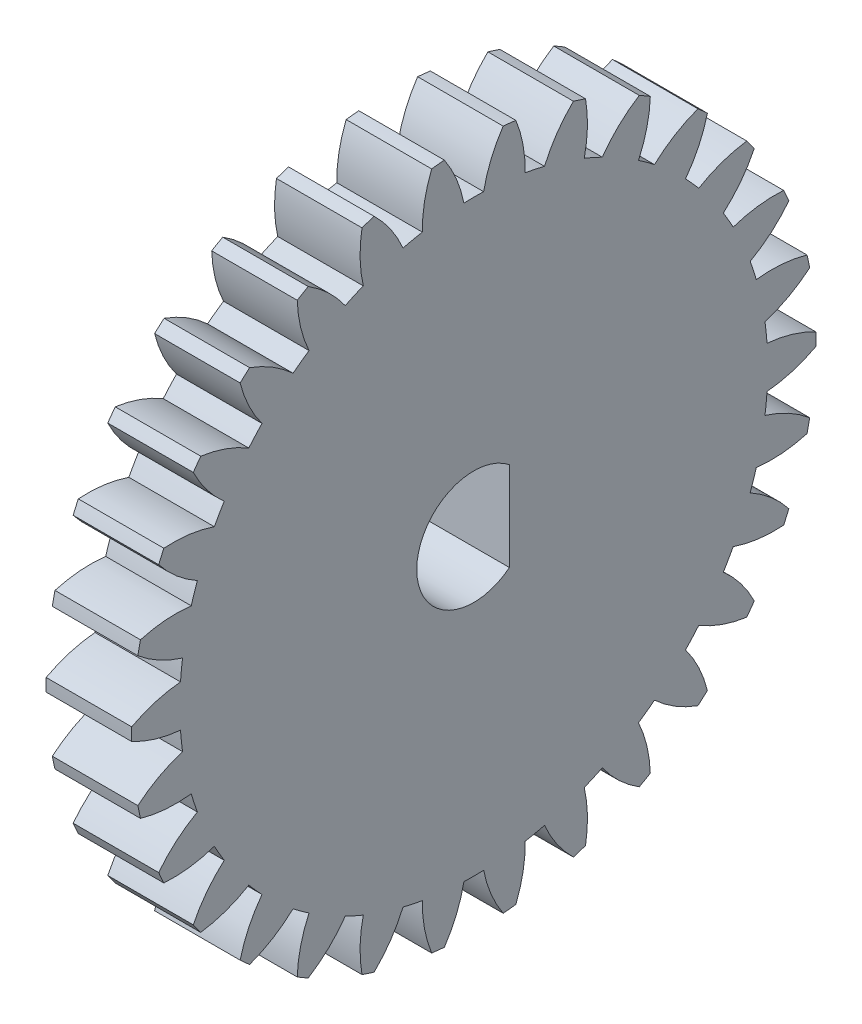
from build123d import *

# Parameters (mm, degrees)
BASPROSKE_W        = 12
BASPROSKE_H        = 24
TOOTHCUT_DEPTH     = 37
TEETHCUTS_COUNT    = 30
TEETHCUTS_ANGLE    = 348
BORSKE_R           = 0.4
BORE_DEPTH         = 50.0000508
SKETCH1_R          = 33.841637192
CUT_EXTRUDE1_DEPTH = 6
CUT_EXTRUDE2_DEPTH = 6


with BuildPart() as part:
    # BasProSke → Base-Revolve (revolve)
    with BuildSketch(Plane(origin=(0, 0, 0), x_dir=(1, 0, 0), z_dir=(0, 1, 0)), mode=Mode.PRIVATE) as base_revolve_sk:
        with Locations((6, 12)):
            Rectangle(BASPROSKE_W, BASPROSKE_H)
    revolve(base_revolve_sk.sketch.rotate(Axis((-10, 0, 0), (1, 0, 0)), 180), axis=Axis((-10, 0, 0), (1, 0, 0)))

    # TooCutSke → ToothCut (cut, through all)
    with BuildSketch(Plane(origin=(0, 0, 0), x_dir=(0, 0, -1), z_dir=(1, 0, 0))):
        with BuildLine():
            ThreePointArc((0.693278797, 20.612344372), (0, 20.624), (-0.693278797, 20.612344372))
            ThreePointArc((-0.693278797, 20.612344372), (-1.219042225, 22.34383125), (-2.080549663, 23.935144835))
            ThreePointArc((-2.080549663, 23.935144835), (0, 24.0254), (2.080549663, 23.935144835))
            ThreePointArc((2.080549663, 23.935144835), (1.219042225, 22.34383125), (0.693278797, 20.612344372))
        make_face()
    toothcut = extrude(amount=TOOTHCUT_DEPTH, mode=Mode.SUBTRACT)

    # TeethCuts: ToothCut ×30 about axis
    teethcuts_axis = Axis((-10, 0, 0), (1, 0, 0))
    for i in range(1, TEETHCUTS_COUNT):
        add(toothcut.rotate(teethcuts_axis, i * TEETHCUTS_ANGLE / (TEETHCUTS_COUNT - 1)), mode=Mode.SUBTRACT)

    # BorSke → Bore (cut, symmetric)
    with BuildSketch(Plane(origin=(0, 0, 0), x_dir=(0, 0, -1), z_dir=(1, 0, 0))):
        with Locations(Location((0, 0, 0), (0, 0, 180))):
            Circle(BORSKE_R)
    extrude(amount=BORE_DEPTH, both=True, mode=Mode.SUBTRACT)

    # Sketch1 → Cut-Extrude1 (cut)
    with BuildSketch(Plane.ZY):
        with Locations((-0.4, 0)):
            Circle(SKETCH1_R)
    extrude(amount=-CUT_EXTRUDE1_DEPTH, mode=Mode.SUBTRACT)

    # Sketch2 → Cut-Extrude2 (cut)
    with BuildSketch(Plane.ZY.offset(-6)):
        with BuildLine():
            ThreePointArc((4, 0), (1.732050808, 3.605551275), (-2.5, 3.122498999))
            Line((-2.5, 3.122498999), (-2.5, -3.122498999))
            ThreePointArc((-2.5, -3.122498999), (1.732050808, -3.605551275), (4, 0))
        make_face()
    extrude(amount=-CUT_EXTRUDE2_DEPTH, mode=Mode.SUBTRACT)


solid = part.part
